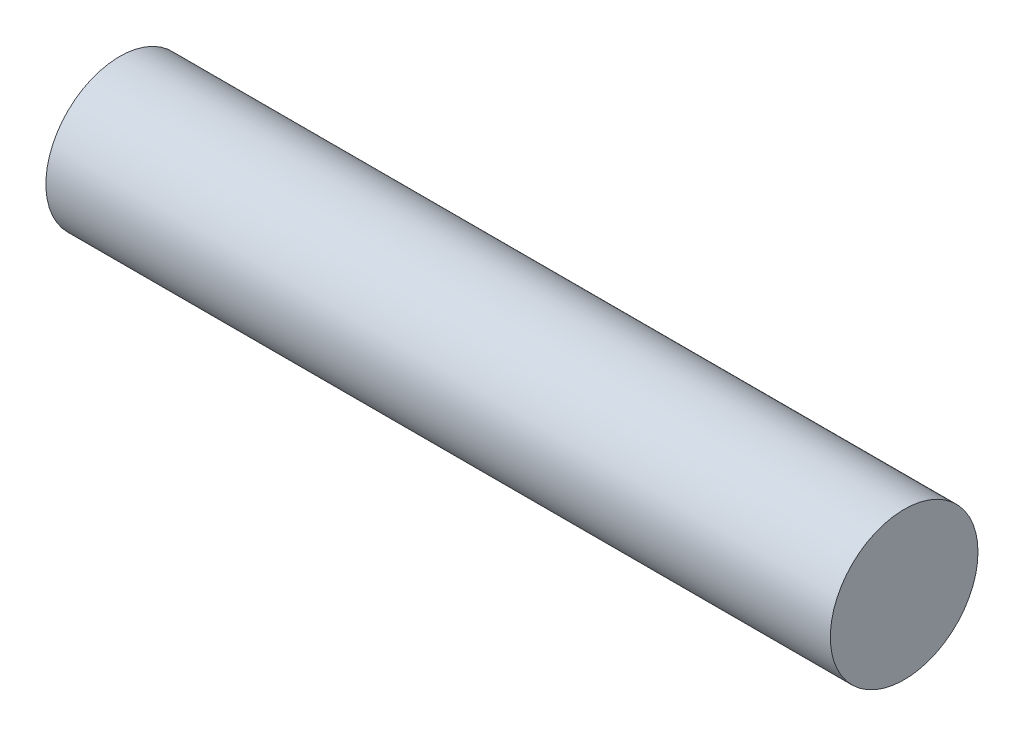
from build123d import *

# Parameters (mm, degrees)
SKETCH1_R          = 80
FOAMBODY_DEPTH     = 425
BATTERY_START      = 10
SKETCH2_W          = 165
SKETCH2_H          = 60
BATTERY_BAY_DEPTH  = 60
FOAM_START         = 10
SKETCH3_W          = 150
SKETCH3_H          = 80
FOAM_DEPTH         = 35
BATTERY_DEPTH      = 3
BATTERY_DEPTH_BACK = 47
SKETCH4_W          = 155
SKETCH4_H          = 48
FC_START           = 13
SKETCH5_W          = 52
SKETCH5_H          = 32
FC_DEPTH           = 17


with BuildPart() as part:
    # Sketch1 → FoamBody (new, symmetric)
    with BuildSketch(Plane(origin=(0, 0, 0), x_dir=(0, 0, -1), z_dir=(1, 0, 0))):
        Circle(SKETCH1_R)
    extrude(amount=FOAMBODY_DEPTH, both=True)

    # Sketch2 → battery bay (cut)
    with BuildSketch(Plane(origin=(0, 0, 0), x_dir=(1, 0, 0), z_dir=(0, 1, 0)).offset(BATTERY_START)):
        with Locations((-269, 0)):
            Rectangle(SKETCH2_W, SKETCH2_H)
    extrude(amount=-BATTERY_BAY_DEPTH, mode=Mode.SUBTRACT)

    # Sketch3 → Foam (cut)
    with BuildSketch(Plane(origin=(0, 0, 0), x_dir=(1, 0, 0), z_dir=(0, 1, 0)).offset(FOAM_START)):
        with Locations((-225, 0)):
            Rectangle(SKETCH3_W, SKETCH3_H)
    extrude(amount=FOAM_DEPTH, mode=Mode.SUBTRACT)


with BuildPart() as body_2:
    # Sketch4 → Battery (new, two sides: drawn at the far end of the back side and taken through both)
    with BuildSketch(Plane(origin=(0, 0, 0), x_dir=(1, 0, 0), z_dir=(0, 1, 0)).offset(-BATTERY_DEPTH_BACK)):
        with Locations((-269, 0)):
            Rectangle(SKETCH4_W, SKETCH4_H)
    extrude(amount=BATTERY_DEPTH + BATTERY_DEPTH_BACK)


with BuildPart() as body_3:
    # Sketch5 → FC (new body)
    with BuildSketch(Plane(origin=(0, 0, 0), x_dir=(1, 0, 0), z_dir=(0, 1, 0)).offset(FC_START)):
        with Locations((-225, 0)):
            Rectangle(SKETCH5_W, SKETCH5_H)
    extrude(amount=FC_DEPTH)


solid = Compound([part.part, body_2.part, body_3.part])
